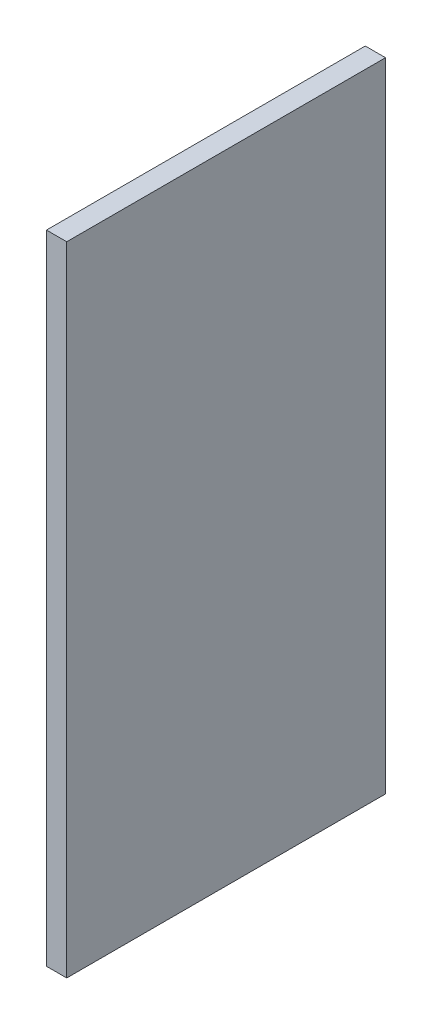
from build123d import *

# Parameters (mm, degrees)
SKETCH1_W           = 100
SKETCH1_H           = 200
BOSS_EXTRUDE1_DEPTH = 6.35


with BuildPart() as part:
    # Sketch1 → Boss-Extrude1 (new body)
    with BuildSketch(Plane(origin=(0, 0, 0), x_dir=(0, 0, -1), z_dir=(1, 0, 0))):
        with Locations((50, -100)):
            Rectangle(SKETCH1_W, SKETCH1_H)
    extrude(amount=BOSS_EXTRUDE1_DEPTH)


solid = part.part
